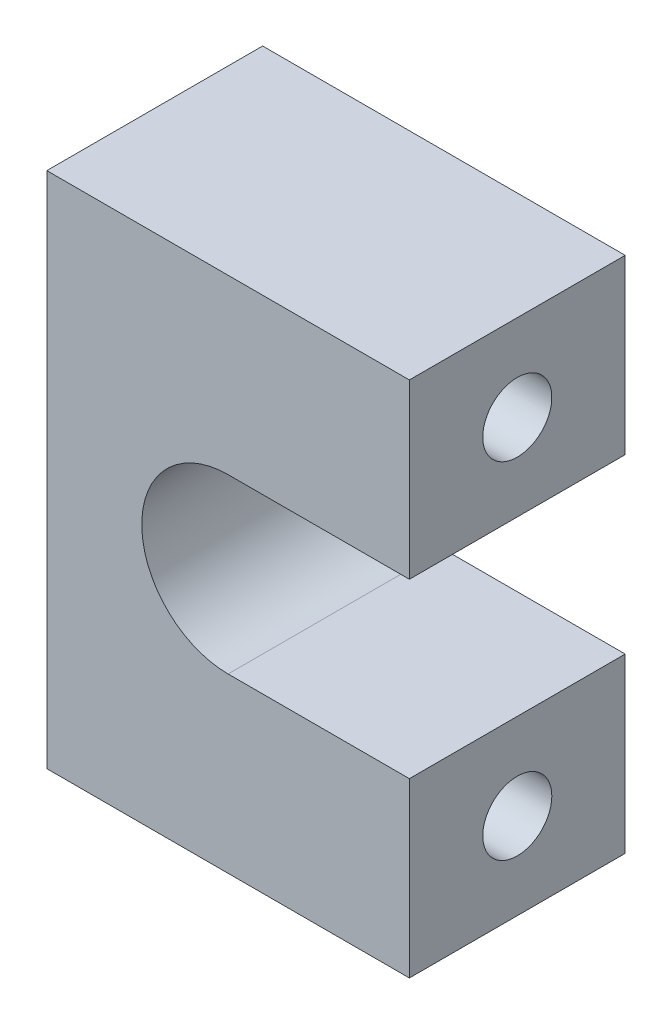
from build123d import *

# Parameters (mm, degrees)
SKETCH1_W           = 42
SKETCH1_H           = 25
BOSS_EXTRUDE1_DEPTH = 60
CUT_EXTRUDE1_DEPTH  = 56
SKETCH3_R           = 4
CUT_EXTRUDE2_DEPTH  = 15


with BuildPart() as part:
    # Sketch1 → Boss-Extrude1 (new body)
    with BuildSketch(Plane(origin=(0, 0, 0), x_dir=(1, 0, 0), z_dir=(0, 1, 0))):
        with Locations((21, 12.5)):
            Rectangle(SKETCH1_W, SKETCH1_H)
    extrude(amount=BOSS_EXTRUDE1_DEPTH)

    # Sketch2 → Cut-Extrude1 (cut)
    with BuildSketch(Plane.XY):
        with BuildLine():
            Line((42, 40), (21, 40))
            ThreePointArc((21, 40), (11, 30), (21, 20))
            Line((21, 20), (42, 20))
            Line((42, 20), (42, 40))
        make_face()
    extrude(amount=-CUT_EXTRUDE1_DEPTH, mode=Mode.SUBTRACT)

    # Sketch3 → Cut-Extrude2 (cut)
    with BuildSketch(Plane(origin=(42, 0, 0), x_dir=(0, 0, -1), z_dir=(1, 0, 0))):
        with Locations((12.5, 10)):
            Circle(SKETCH3_R)
        with Locations(Location((12.5, 50, 0), (0, 0, 180))):
            Circle(SKETCH3_R)
    extrude(amount=-CUT_EXTRUDE2_DEPTH, mode=Mode.SUBTRACT)


solid = part.part
